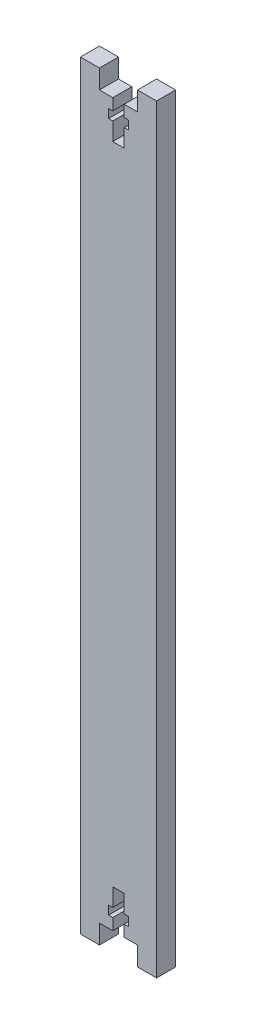
from build123d import *

# Parameters (mm, degrees)
BOSS_EXTRUDE1_DEPTH = 5


with BuildPart() as part:
    # Sketch1 → Boss-Extrude1 (new body)
    with BuildSketch(Plane.XY):
        Polygon((0, 194.5), (0, 5), (0, 0), (-5, 0), (-5, 5), (-8.5, 5), (-8.5, 8), (-7.4, 8), (-7.4, 10.3), (-8.5, 10.3), (-8.5, 15), (-11.5, 15), (-11.5, 10.3), (-12.6, 10.3), (-12.6, 8), (-11.5, 8), (-11.5, 5), (-15, 5), (-15, 0), (-20, 0), (-20, 5), (-20, 194.5), (-20, 199.5), (-15, 199.5), (-15, 194.5), (-11.5, 194.5), (-11.5, 191.5), (-12.6, 191.5), (-12.6, 189.2), (-11.5, 189.2), (-11.5, 184.5), (-8.5, 184.5), (-8.5, 189.2), (-7.4, 189.2), (-7.4, 191.5), (-8.5, 191.5), (-8.5, 194.5), (-5, 194.5), (-5, 199.5), (0, 199.5), align=None)
    extrude(amount=BOSS_EXTRUDE1_DEPTH)


solid = part.part
